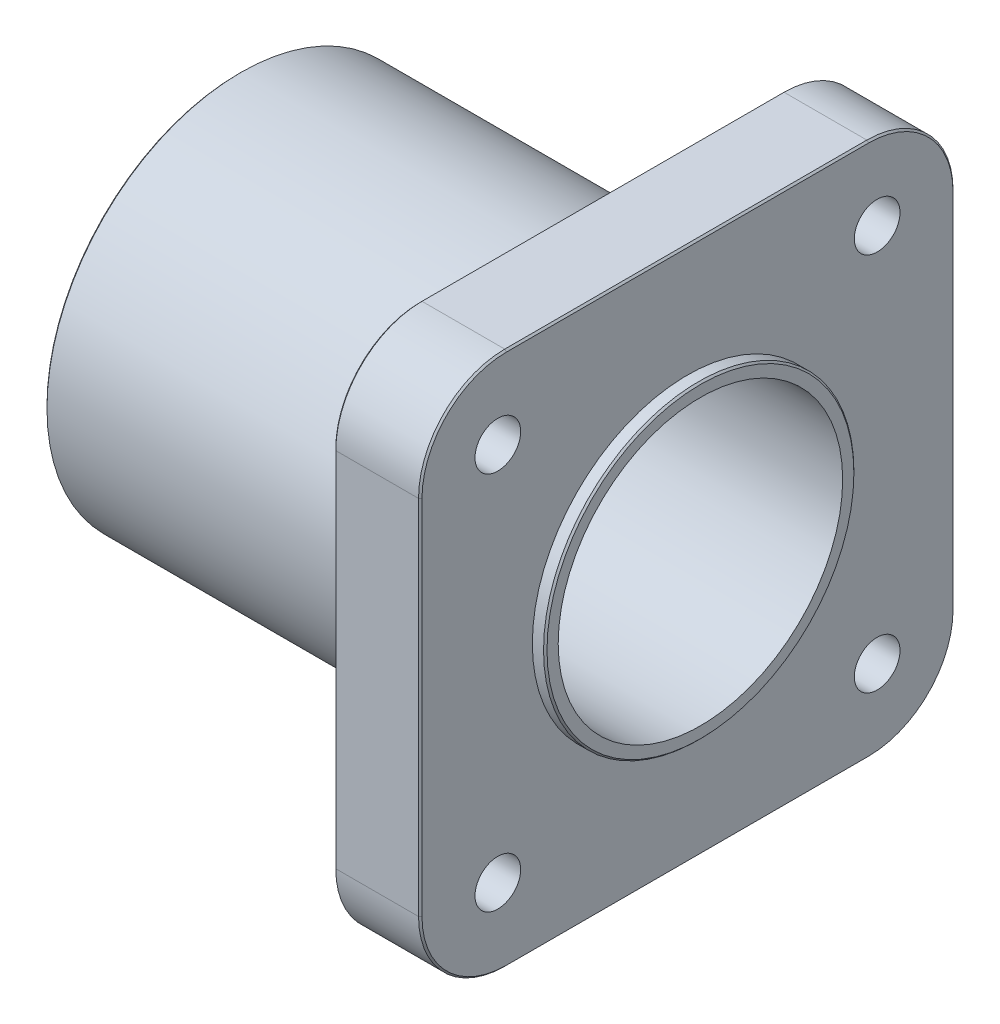
from build123d import *

# Parameters (mm, degrees)
BOSS_EXTRU_1_START = -10
ESQUISSE2_W        = 62
ESQUISSE2_H        = 62
ESQUISSE2_R        = 16.5
BOSS_EXTRU_1_DEPTH = 10
CONG_1_R           = 10
D_GAGEMENT_M51_D   = 5.3
SYM_TRIE2_COPY_1_D = 5.3
CONG_2_R           = 4
ESQUISSE5_R        = 18
ESQUISSE5_R_2      = 16.5
BOSS_EXTRU_2_DEPTH = 1.5
CHANFREIN1_SIZE    = 0.2
CHANFREIN2_SIZE    = 0.2
CHANFREIN3_SIZE    = 0.2
CHANFREIN4_SIZE    = 0.2


with BuildPart() as part:
    # Esquisse1 → Révolution1 (revolve)
    with BuildSketch(Plane.XY, mode=Mode.PRIVATE) as r_volution1_sk:
        Polygon((0, 15), (0, 22.5), (52, 22.5), (52, 16.5), (15, 16.5), (15, 16), (5, 16), (5, 15), align=None)
    revolve(r_volution1_sk.sketch.rotate(Axis((-138.831140815, 0, 0), (1, 0, 0)), 90), axis=Axis((-138.831140815, 0, 0), (1, 0, 0)))

    # Esquisse2 → Boss.-Extru.1 (add)
    with BuildSketch(Plane(origin=(52, 0, 0), x_dir=(0, 0, -1), z_dir=(1, 0, 0)).offset(BOSS_EXTRU_1_START)):
        Rectangle(ESQUISSE2_W, ESQUISSE2_H)
        with Locations(Location((0, 0, 0), (0, 0, 180))):
            Circle(ESQUISSE2_R, mode=Mode.SUBTRACT)
    extrude(amount=BOSS_EXTRU_1_DEPTH)

    # Congé1
    cong_1_edges = [part.edges().sort_by_distance(p)[0] for p in [
        (47, 31, -31),
        (47, -31, -31),
        (47, -31, 31),
        (47, 31, 31),
    ]]
    fillet(cong_1_edges, radius=CONG_1_R)

    # Dégagement M51 (through all)
    with Locations(Plane(origin=(52, 0, 0), x_dir=(0, 0, -1), z_dir=(1, 0, 0))):
        with Locations((22, 22)):
            d_gagement_m51 = Hole(D_GAGEMENT_M51_D / 2)

    # Symétrie1: Dégagement M51 across plane
    add(d_gagement_m51.mirror(Plane.XY), mode=Mode.SUBTRACT)

    # Symétrie2: Dégagement M51 across plane
    add(d_gagement_m51.mirror(Plane.ZX), mode=Mode.SUBTRACT)

    # Symétrie2 copy 1 (through all)
    with Locations(Plane(origin=(52, 0, 0), x_dir=(0, 0, 1), z_dir=(1, 0, 0))):
        with Locations((22, 22)):
            Hole(SYM_TRIE2_COPY_1_D / 2)

    # Congé2
    cong_2_edges = [part.edges().sort_by_distance(p)[0] for p in [
        (42, 0, -22.5),
    ]]
    fillet(cong_2_edges, radius=CONG_2_R)

    # Esquisse5 → Boss.-Extru.2 (add)
    with BuildSketch(Plane(origin=(52, 0, 0), x_dir=(0, 0, -1), z_dir=(1, 0, 0))):
        with Locations(Location((0, 0, 0), (0, 0, 180))):
            Circle(ESQUISSE5_R)
        with Locations(Location((0, 0, 0), (0, 0, 180))):
            Circle(ESQUISSE5_R_2, mode=Mode.SUBTRACT)
    extrude(amount=BOSS_EXTRU_2_DEPTH)

    # Chanfrein1
    chanfrein1_edges = [part.edges().sort_by_distance(p)[0] for p in [
        (53.5, 0, -18),
    ]]
    chamfer(chanfrein1_edges, length=CHANFREIN1_SIZE)

    # Chanfrein2
    chanfrein2_edges = [part.edges().sort_by_distance(p)[0] for p in [
        (52, 0, 31),
        (52, 0, -31),
        (52, 31, 0),
        (52, -31, 0),
        (52, 28.071067812, 28.071067812),
        (52, 28.071067812, -28.071067812),
        (52, -28.071067812, -28.071067812),
        (52, -28.071067812, 28.071067812),
    ]]
    chamfer(chanfrein2_edges, length=CHANFREIN2_SIZE)

    # Chanfrein3
    chanfrein3_edges = [part.edges().sort_by_distance(p)[0] for p in [
        (42, 0, 31),
        (42, -31, 0),
        (42, 0, -31),
        (42, 31, 0),
        (42, 28.071067812, 28.071067812),
        (42, 28.071067812, -28.071067812),
        (42, -28.071067812, -28.071067812),
        (42, -28.071067812, 28.071067812),
    ]]
    chamfer(chanfrein3_edges, length=CHANFREIN3_SIZE)

    # Chanfrein4
    chanfrein4_edges = [part.edges().sort_by_distance(p)[0] for p in [
        (0, 0, -15),
        (0, 0, -22.5),
    ]]
    chamfer(chanfrein4_edges, length=CHANFREIN4_SIZE)


solid = part.part
